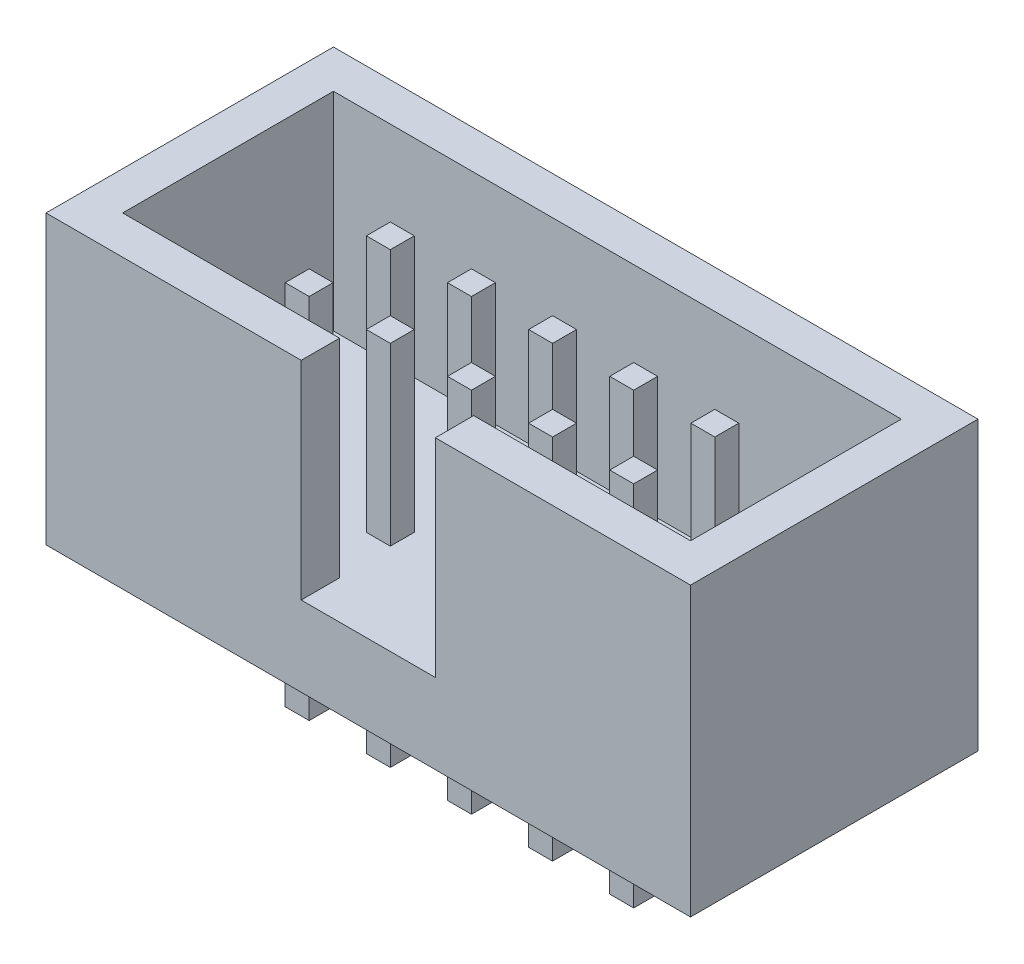
from build123d import *

# Parameters (mm, degrees)
SKETCH_1_W           = 20.18
SKETCH_1_H           = 9
EXTRUDE_1_DEPTH      = 9
SKETCH_2_W           = 17.78
SKETCH_2_H           = 6.6
CUT_EXTRUDE_1_DEPTH  = 6.5
SKETCH_3_W           = 4.2
SKETCH_3_H           = 6.5
CUT_EXTRUDE_2_DEPTH  = 6.5
EXTRUDE_2_DEPTH      = 3.5
EXTRUDE_2_DEPTH_BACK = 8
SKETCH_5_W           = 0.75
SKETCH_5_H           = 0.75


with BuildPart() as part:
    # 草图1 → 拉伸1 (new body)
    with BuildSketch(Plane(origin=(0, 0, 0), x_dir=(1, 0, 0), z_dir=(0, 1, 0))):
        Rectangle(SKETCH_1_W, SKETCH_1_H)
    extrude(amount=EXTRUDE_1_DEPTH)

    # 草图2 → 切除-拉伸1 (cut)
    with BuildSketch(Plane(origin=(0, 9, 0), x_dir=(-1, 0, 0), z_dir=(0, 1, 0))):
        Rectangle(SKETCH_2_W, SKETCH_2_H)
    extrude(amount=-CUT_EXTRUDE_1_DEPTH, mode=Mode.SUBTRACT)

    # 草图3 → 切除-拉伸2 (cut)
    with BuildSketch(Plane.XY.offset(4.5)):
        with Locations((0, 5.75)):
            Rectangle(SKETCH_3_W, SKETCH_3_H)
    extrude(amount=-CUT_EXTRUDE_2_DEPTH, mode=Mode.SUBTRACT)

    # 草图5 → 拉伸2 (add, two sides: drawn at the far end of the back side and taken through both)
    with BuildSketch(Plane.XZ.offset(-EXTRUDE_2_DEPTH_BACK)):
        with Locations((0, 1.27)):
            Rectangle(SKETCH_5_W, SKETCH_5_H)
        with Locations((2.54, 1.27)):
            Rectangle(SKETCH_5_W, SKETCH_5_H)
        with Locations((5.08, 1.27)):
            Rectangle(SKETCH_5_W, SKETCH_5_H)
        with Locations((-2.54, 1.27)):
            Rectangle(SKETCH_5_W, SKETCH_5_H)
        with Locations((-5.08, 1.27)):
            Rectangle(SKETCH_5_W, SKETCH_5_H)
        with Locations((-5.08, -1.27)):
            Rectangle(SKETCH_5_W, SKETCH_5_H)
        with Locations((-2.54, -1.27)):
            Rectangle(SKETCH_5_W, SKETCH_5_H)
        with Locations((5.08, -1.27)):
            Rectangle(SKETCH_5_W, SKETCH_5_H)
        with Locations((2.54, -1.27)):
            Rectangle(SKETCH_5_W, SKETCH_5_H)
        with Locations((0, -1.27)):
            Rectangle(SKETCH_5_W, SKETCH_5_H)
    extrude(amount=EXTRUDE_2_DEPTH + EXTRUDE_2_DEPTH_BACK)


solid = part.part
